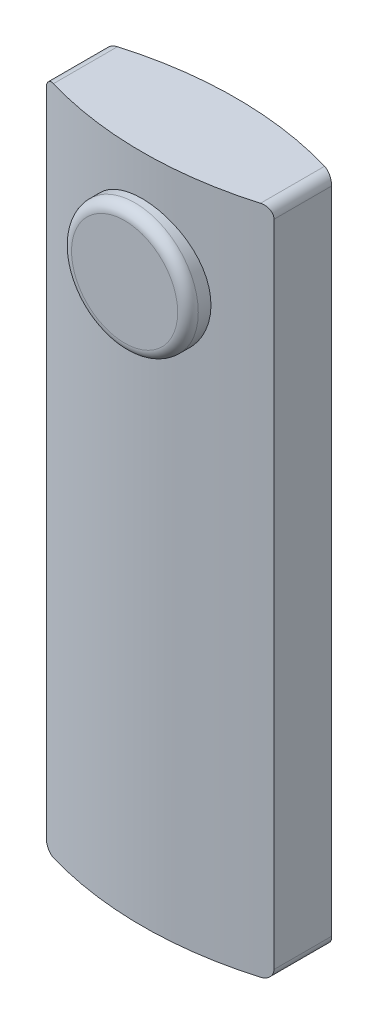
from build123d import *

# Parameters (mm, degrees)
BOSS_EXTRUDE1_DEPTH = 130.12
SKETCH6_R           = 12.3
BOSS_EXTRUDE2_DEPTH = 12.5
SKETCH7_R           = 2.35
BOSS_EXTRUDE3_DEPTH = 2
FILLET1_R           = 2
FILLET2_R           = 2
FILLET3_R           = 2


with BuildPart() as part:
    # Sketch5 → Boss-Extrude1 (new body)
    with BuildSketch(Plane(origin=(0, 0, 0), x_dir=(1, 0, 0), z_dir=(0, 1, 0))):
        with BuildLine():
            Line((-22.1, 5.6), (-22.1, -5.6))
            ThreePointArc((-22.1, -5.6), (0, -9.1), (22.1, -5.6))
            Line((22.1, -5.6), (22.1, 5.6))
            ThreePointArc((22.1, 5.6), (0, 9.1), (-22.1, 5.6))
        make_face()
    extrude(amount=BOSS_EXTRUDE1_DEPTH)

    # Sketch6 → Boss-Extrude2 (add, symmetric)
    with BuildSketch(Plane.XY):
        with Locations(Location((0, 110, 0), (0, 0, 180))):
            Circle(SKETCH6_R)
    extrude(amount=BOSS_EXTRUDE2_DEPTH, both=True)

    # Sketch7 → Boss-Extrude3 (add)
    with BuildSketch(Plane.ZY.offset(22.1)):
        with Locations(Location((0, 94.5, 0), (0, 0, 180))):
            Circle(SKETCH7_R)
        with Locations(Location((0, 79.5, 0), (0, 0, 180))):
            Circle(SKETCH7_R)
        with Locations(Location((0, 64.5, 0), (0, 0, 180))):
            Circle(SKETCH7_R)
    extrude(amount=BOSS_EXTRUDE3_DEPTH)

    # Fillet1
    fillet1_edges = [part.edges().sort_by_distance(p)[0] for p in [
        (12.3, 110, 12.5),
    ]]
    fillet(fillet1_edges, radius=FILLET1_R)

    # Fillet2
    fillet2_edges = [part.edges().sort_by_distance(p)[0] for p in [
        (22.1, 130.12, 0),
        (-22.1, 130.12, 0),
    ]]
    fillet(fillet2_edges, radius=FILLET2_R)

    # Fillet3
    fillet3_edges = [part.edges().sort_by_distance(p)[0] for p in [
        (22.1, 0, 0),
        (-22.1, 0, 0),
    ]]
    fillet(fillet3_edges, radius=FILLET3_R)


solid = part.part
